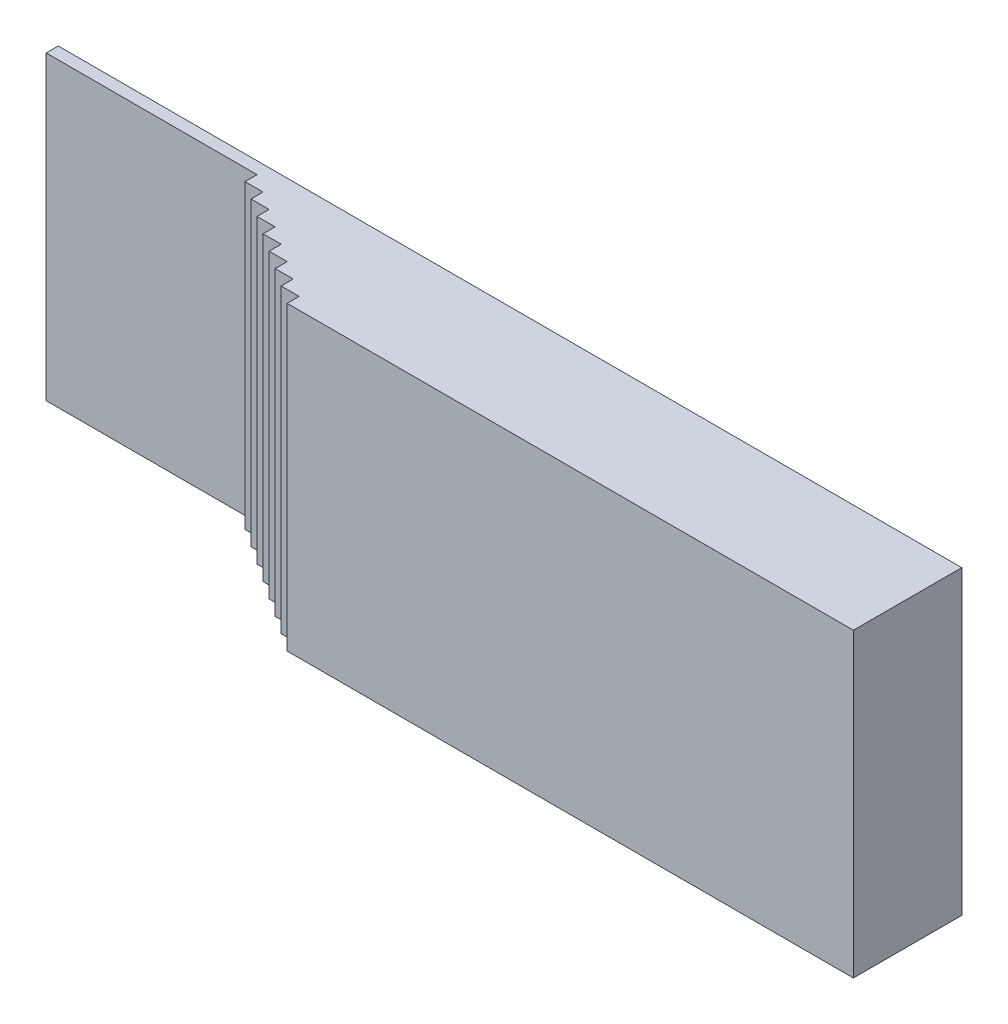
from build123d import *

# Parameters (mm, degrees)
SKETCH3_W            = 15000
SKETCH3_H            = 5000
BOSS_EXTRUDE1_DEPTH  = 200
SKETCH4_W            = 300
SKETCH4_H            = 5000
STEP1_DEPTH          = 200
SKETCH4_4_W          = 300
SKETCH4_4_H          = 5000
STEP2_DEPTH          = 400
SKETCH4_5_W          = 300
SKETCH4_5_H          = 5000
STEP3_DEPTH          = 600
SKETCH4_6_W          = 300
SKETCH4_6_H          = 5000
STEP4_DEPTH          = 800
SKETCH4_7_W          = 300
SKETCH4_7_H          = 5000
BOSS_EXTRUDE7_DEPTH  = 1000
SKETCH4_8_W          = 300
SKETCH4_8_H          = 5000
BOSS_EXTRUDE8_DEPTH  = 1200
SKETCH4_9_W          = 300
SKETCH4_9_H          = 5000
BOSS_EXTRUDE9_DEPTH  = 1400
SKETCH4_10_W         = 300
SKETCH4_10_H         = 5000
BOSS_EXTRUDE10_DEPTH = 1600
SKETCH8_W            = 9100
SKETCH8_H            = 5000
BOSS_EXTRUDE11_DEPTH = 1600


with BuildPart() as part:
    # Sketch3 → Boss-Extrude1 (new body)
    with BuildSketch(Plane.XY):
        with Locations((5000, 0)):
            Rectangle(SKETCH3_W, SKETCH3_H)
    extrude(amount=BOSS_EXTRUDE1_DEPTH)

    # Sketch4 → Step1 (add)
    with BuildSketch(Plane.XY.offset(200)):
        with Locations((1150, 0)):
            Rectangle(SKETCH4_W, SKETCH4_H)
    extrude(amount=STEP1_DEPTH)

    # Sketch4<4> → Step2 (add)
    with BuildSketch(Plane.XY.offset(200)):
        with Locations((1450, 0)):
            Rectangle(SKETCH4_4_W, SKETCH4_4_H)
    extrude(amount=STEP2_DEPTH)

    # Sketch4<5> → Step3 (add)
    with BuildSketch(Plane.XY.offset(200)):
        with Locations((1750, 0)):
            Rectangle(SKETCH4_5_W, SKETCH4_5_H)
    extrude(amount=STEP3_DEPTH)

    # Sketch4<6> → Step4 (add)
    with BuildSketch(Plane.XY.offset(200)):
        with Locations((2050, 0)):
            Rectangle(SKETCH4_6_W, SKETCH4_6_H)
    extrude(amount=STEP4_DEPTH)

    # Sketch4<7> → Boss-Extrude7 (add)
    with BuildSketch(Plane.XY.offset(200)):
        with Locations((2350, 0)):
            Rectangle(SKETCH4_7_W, SKETCH4_7_H)
    extrude(amount=BOSS_EXTRUDE7_DEPTH)

    # Sketch4<8> → Boss-Extrude8 (add)
    with BuildSketch(Plane.XY.offset(200)):
        with Locations((2650, 0)):
            Rectangle(SKETCH4_8_W, SKETCH4_8_H)
    extrude(amount=BOSS_EXTRUDE8_DEPTH)

    # Sketch4<9> → Boss-Extrude9 (add)
    with BuildSketch(Plane.XY.offset(200)):
        with Locations((2950, 0)):
            Rectangle(SKETCH4_9_W, SKETCH4_9_H)
    extrude(amount=BOSS_EXTRUDE9_DEPTH)

    # Sketch4<10> → Boss-Extrude10 (add)
    with BuildSketch(Plane.XY.offset(200)):
        with Locations((3250, 0)):
            Rectangle(SKETCH4_10_W, SKETCH4_10_H)
    extrude(amount=BOSS_EXTRUDE10_DEPTH)

    # Sketch8 → Boss-Extrude11 (add)
    with BuildSketch(Plane.XY.offset(200)):
        with Locations((7950, 0)):
            Rectangle(SKETCH8_W, SKETCH8_H)
    extrude(amount=BOSS_EXTRUDE11_DEPTH)


solid = part.part
